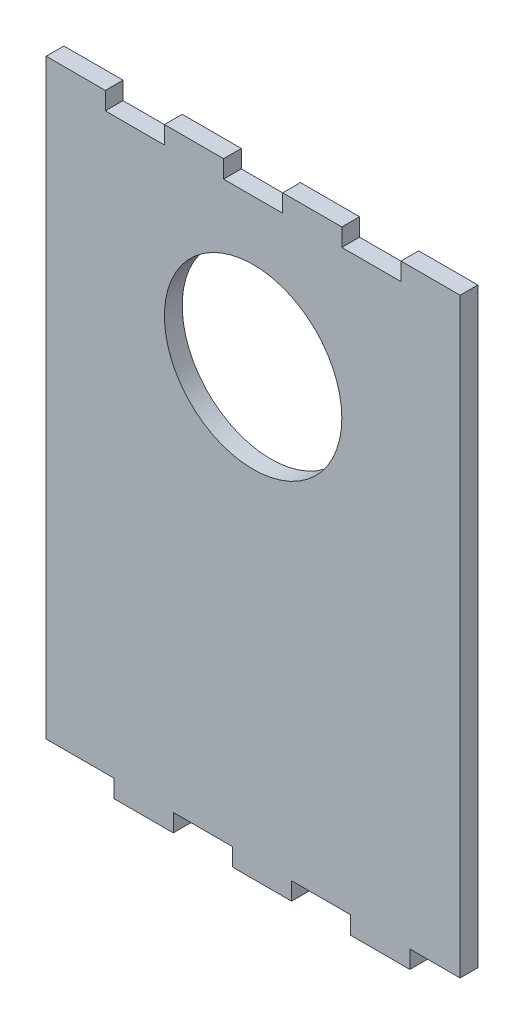
from build123d import *

# Parameters (mm, degrees)
SKETCH1_W           = 70
SKETCH1_H           = 100
SKETCH1_W_2         = 10
SKETCH1_H_2         = 3
BOSS_EXTRUDE1_DEPTH = 3
SKETCH2_W           = 10
SKETCH2_H           = 3
CUT_EXTRUDE1_DEPTH  = 64.584589328
SKETCH3_R           = 15
CUT_EXTRUDE2_DEPTH  = 64.584589328


with BuildPart() as part:
    # Sketch1 → Boss-Extrude1 (new body)
    with BuildSketch(Plane.XY):
        Rectangle(SKETCH1_W, SKETCH1_H)
        with Locations((21.5, -51.5)):
            Rectangle(SKETCH1_W_2, SKETCH1_H_2)
        with Locations((1.5, -51.5)):
            Rectangle(SKETCH1_W_2, SKETCH1_H_2)
        with Locations((-18.5, -51.5)):
            Rectangle(SKETCH1_W_2, SKETCH1_H_2)
    extrude(amount=BOSS_EXTRUDE1_DEPTH)

    # Sketch2 → Cut-Extrude1 (cut, through all)
    with BuildSketch(Plane.XY.offset(3)):
        with Locations((-20, 48.5)):
            Rectangle(SKETCH2_W, SKETCH2_H)
        with Locations((0, 48.5)):
            Rectangle(SKETCH2_W, SKETCH2_H)
        with Locations((20, 48.5)):
            Rectangle(SKETCH2_W, SKETCH2_H)
    extrude(amount=-CUT_EXTRUDE1_DEPTH, mode=Mode.SUBTRACT)

    # Sketch3 → Cut-Extrude2 (cut, through all)
    with BuildSketch(Plane.XY.offset(3)):
        with Locations((0, 22)):
            Circle(SKETCH3_R)
    extrude(amount=-CUT_EXTRUDE2_DEPTH, mode=Mode.SUBTRACT)


solid = part.part
